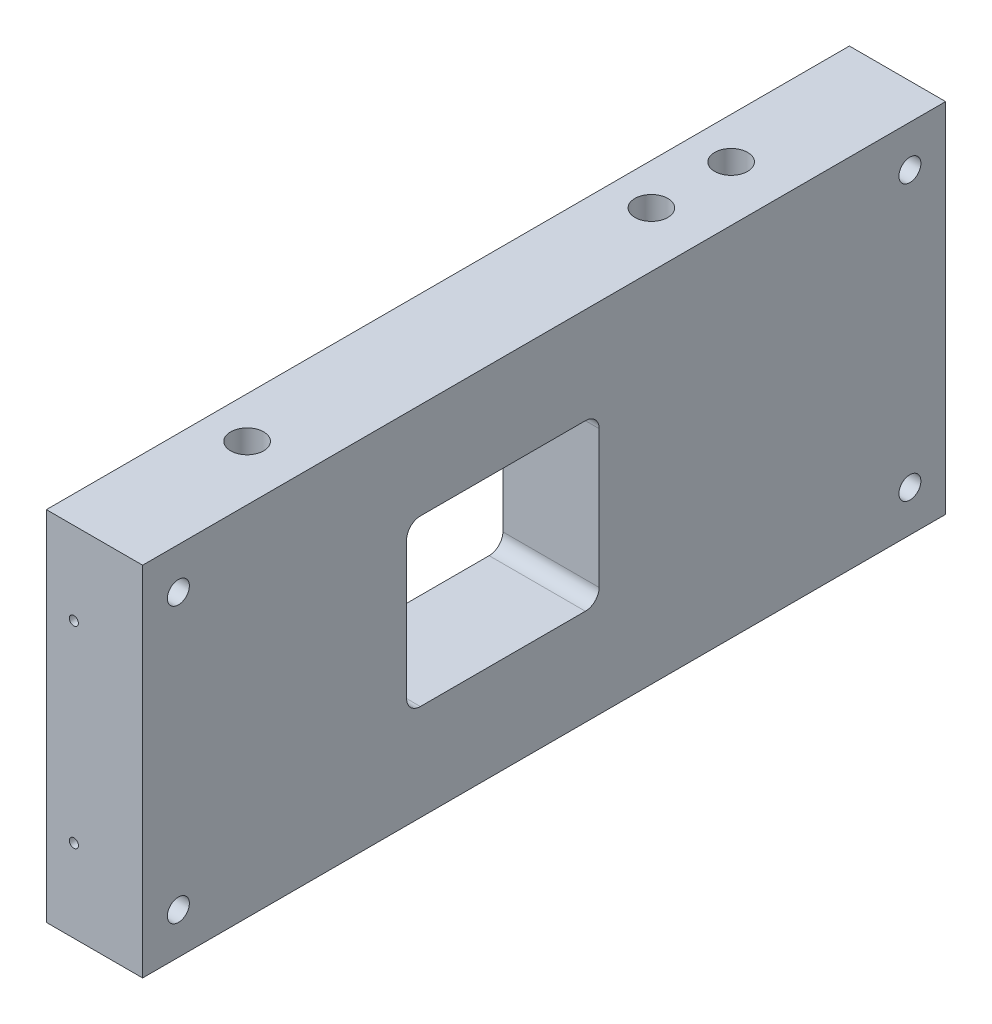
from build123d import *

# Parameters (mm, degrees)
SKETCH2_W                   = 191
SKETCH2_H                   = 130
BOSS_EXTRUDE1_DEPTH         = 35
SKETCH10_W                  = 35
SKETCH10_H                  = 130
BOSS_EXTRUDE2_DEPTH         = 101
TAP_DRILL_FOR_M4_TAP2_D     = 3.3
TAP_DRILL_FOR_M4_TAP2_DEPTH = 6
TAP_DRILL_FOR_M4_TAP2_TIP   = 0.991420021
TAP_DRILL_FOR_M4_TAP3_D     = 3.3
TAP_DRILL_FOR_M4_TAP3_DEPTH = 6
TAP_DRILL_FOR_M4_TAP3_TIP   = 0.991420021
CUT_EXTRUDE1_DEPTH          = 205.770603359
F_8_0MM_DOWEL_HOLE1_D       = 8
CUT_EXTRUDE3_DEPTH          = 30
F_8_0MM_DOWEL_HOLE2_D       = 8
F_8_0MM_DOWEL_HOLE2_DEPTH   = 10
F_8_0MM_DOWEL_HOLE2_TIP     = 2.403442476
F_12_0MM_DOWEL_HOLE1_D      = 12
F_12_0MM_DOWEL_HOLE1_DEPTH  = 10
F_12_0MM_DOWEL_HOLE1_TIP    = 3.605163714


with BuildPart() as part:
    # Sketch2 → Boss-Extrude1 (new body)
    with BuildSketch(Plane(origin=(0, 0, 0), x_dir=(0, 0, -1), z_dir=(1, 0, 0))):
        with Locations((95.5, 0)):
            Rectangle(SKETCH2_W, SKETCH2_H)
    extrude(amount=BOSS_EXTRUDE1_DEPTH)

    # Sketch10 → Boss-Extrude2 (add)
    with BuildSketch(Plane.XY):
        with Locations((17.5, 0)):
            Rectangle(SKETCH10_W, SKETCH10_H)
    extrude(amount=BOSS_EXTRUDE2_DEPTH)

    # Tap Drill for M4 Tap2
    with Locations(Plane(origin=(0, 0, -191), x_dir=(-1, 0, 0), z_dir=(0, 0, -1))):
        with Locations((-40, 35), (-10, 35), (-10, -35), (-40, -35)):
            Hole(TAP_DRILL_FOR_M4_TAP2_D / 2, depth=TAP_DRILL_FOR_M4_TAP2_DEPTH)
            with Locations((0, 0, -(TAP_DRILL_FOR_M4_TAP2_DEPTH + TAP_DRILL_FOR_M4_TAP2_TIP / 2))):  # 118° drill point
                Cone(0, TAP_DRILL_FOR_M4_TAP2_D / 2, TAP_DRILL_FOR_M4_TAP2_TIP, mode=Mode.SUBTRACT)

    # Tap Drill for M4 Tap3
    with Locations(Plane.XY.offset(101)):
        with Locations((10, 35), (40, 35), (40, -35), (10, -35)):
            Hole(TAP_DRILL_FOR_M4_TAP3_D / 2, depth=TAP_DRILL_FOR_M4_TAP3_DEPTH)
            with Locations((0, 0, -(TAP_DRILL_FOR_M4_TAP3_DEPTH + TAP_DRILL_FOR_M4_TAP3_TIP / 2))):  # 118° drill point
                Cone(0, TAP_DRILL_FOR_M4_TAP3_D / 2, TAP_DRILL_FOR_M4_TAP3_TIP, mode=Mode.SUBTRACT)

    # Sketch23 → Cut-Extrude1 (cut, through all)
    with BuildSketch(Plane.ZY):
        with BuildLine():
            Line((-65, 25), (-65, -25))
            ThreePointArc((-65, -25), (-63.535533906, -28.535533906), (-60, -30))
            Line((-60, -30), (0, -30))
            ThreePointArc((0, -30), (3.535533906, -28.535533906), (5, -25))
            Line((5, -25), (5, 25))
            ThreePointArc((5, 25), (3.535533906, 28.535533906), (0, 30))
            Line((0, 30), (-60, 30))
            ThreePointArc((-60, 30), (-63.535533906, 28.535533906), (-65, 25))
        make_face()
    extrude(amount=-CUT_EXTRUDE1_DEPTH, mode=Mode.SUBTRACT)

    # Ø8.0mm Dowel Hole1 (through all)
    with Locations(Plane(origin=(35, 0, 0), x_dir=(0, 0, -1), z_dir=(1, 0, 0))):
        with Locations((-88, 50), (-88, -50), (178, -50), (178, 50)):
            Hole(F_8_0MM_DOWEL_HOLE1_D / 2)

    # Sketch35 → Cut-Extrude3 (cut)
    with BuildSketch(Plane.ZY):
        with BuildLine():
            Line((-151, 55), (-85, 55))
            ThreePointArc((-85, 55), (-77.928932188, 52.071067812), (-75, 45))
            Line((-75, 45), (-75, -45))
            ThreePointArc((-75, -45), (-77.928932188, -52.071067812), (-85, -55))
            Line((-85, -55), (-151, -55))
            ThreePointArc((-151, -55), (-158.071067812, -52.071067812), (-161, -45))
            Line((-161, -45), (-161, 45))
            ThreePointArc((-161, 45), (-158.071067812, 52.071067812), (-151, 55))
        make_face()
        with BuildLine():
            Line((25, 55), (61, 55))
            ThreePointArc((61, 55), (68.071067812, 52.071067812), (71, 45))
            Line((71, 45), (71, -45))
            ThreePointArc((71, -45), (68.071067812, -52.071067812), (61, -55))
            Line((61, -55), (25, -55))
            ThreePointArc((25, -55), (17.928932188, -52.071067812), (15, -45))
            Line((15, -45), (15, 45))
            ThreePointArc((15, 45), (17.928932188, 52.071067812), (25, 55))
        make_face()
    extrude(amount=-CUT_EXTRUDE3_DEPTH, mode=Mode.SUBTRACT)

    # Ø8.0mm Dowel Hole2
    with Locations(Plane(origin=(0, -55, 0), x_dir=(1, 0, 0), z_dir=(0, 1, 0))):
        with Locations((15, 133), (15, 104), (15, -43)):
            Hole(F_8_0MM_DOWEL_HOLE2_D / 2, depth=F_8_0MM_DOWEL_HOLE2_DEPTH)
            with Locations((0, 0, -(F_8_0MM_DOWEL_HOLE2_DEPTH + F_8_0MM_DOWEL_HOLE2_TIP / 2))):  # 118° drill point
                Cone(0, F_8_0MM_DOWEL_HOLE2_D / 2, F_8_0MM_DOWEL_HOLE2_TIP, mode=Mode.SUBTRACT)

    # Ø12.0mm Dowel Hole1
    with Locations(Plane(origin=(0, 65, 0), x_dir=(1, 0, 0), z_dir=(0, 1, 0))):
        with Locations((15, 133), (15, 104), (15, -43)):
            Hole(F_12_0MM_DOWEL_HOLE1_D / 2, depth=F_12_0MM_DOWEL_HOLE1_DEPTH)
            with Locations((0, 0, -(F_12_0MM_DOWEL_HOLE1_DEPTH + F_12_0MM_DOWEL_HOLE1_TIP / 2))):  # 118° drill point
                Cone(0, F_12_0MM_DOWEL_HOLE1_D / 2, F_12_0MM_DOWEL_HOLE1_TIP, mode=Mode.SUBTRACT)


solid = part.part
